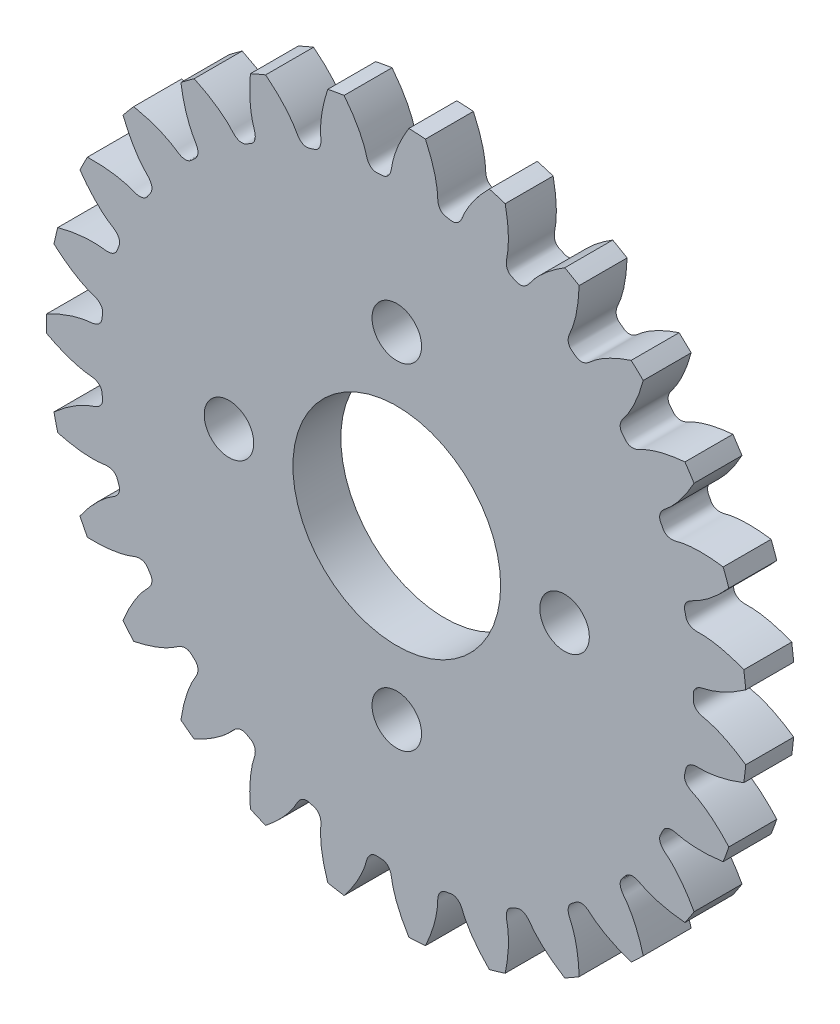
from build123d import *

# Parameters (mm, degrees)
SKETCH_334_W               = 3
SKETCH_334_H               = 21.929999671
CUT_EXTRUDE_579_DEPTH      = 1.5
PATTERN_CIRCULAR_631_COUNT = 27
SKETCH_5_R                 = 6.5
SKETCH_5_R_2               = 1.55
CUT_EXTRUDE_2_DEPTH        = 10


with BuildPart() as part:
    # Sketch 334 → Revolve 360 (revolve)
    with BuildSketch(Plane(origin=(0, 0, 0), x_dir=(0, 0, -1), z_dir=(1, 0, 0))):
        with Locations((0, 10.964999836)):
            Rectangle(SKETCH_334_W, SKETCH_334_H)
    revolve(axis=Axis((0, 0, 0), (0, 0, -1)))

    # Sketch 405 → Cut-Extrude 579 (cut, symmetric)
    with BuildSketch(Plane.XY):
        with BuildLine():
            ThreePointArc((21.914982429, 2.085599809), (22.013999669, 0), (21.914982429, -2.085599809))
            add(Edge.make_bspline(
                [(21.914982429, -2.085599809), (21.871911949, -2.054738562), (21.807384847, -2.009200425), (21.721241428, -1.949812773), (21.65756037, -1.906590462), (21.594403253, -1.864391236), (21.531781543, -1.823205162), (21.469706589, -1.783022194), (21.408189623, -1.743832174), (21.347241759, -1.705624836), (21.28687399, -1.668389802), (21.227097187, -1.632116588), (21.1679221, -1.596794605), (21.109359357, -1.562413158), (21.05141946, -1.528961446), (20.994112787, -1.496428568), (20.937449592, -1.464803521), (20.881439999, -1.434075201), (20.826094007, -1.404232406), (20.771421485, -1.375263835), (20.717432173, -1.347158092), (20.664135681, -1.319903685), (20.611541487, -1.293489029), (20.559658939, -1.267902447), (20.508497249, -1.243132169), (20.458065498, -1.219166337), (20.408372631, -1.195993002), (20.359427459, -1.173600131), (20.311238655, -1.151975603), (20.263814757, -1.131107212), (20.217164164, -1.110982672), (20.171295138, -1.091589611), (20.1262158, -1.072915579), (20.081934132, -1.054948047), (20.038457976, -1.037674408), (19.995795032, -1.021081978), (19.953952858, -1.005157998), (19.91293887, -0.989889636), (19.87276034, -0.975263989), (19.833424395, -0.961268082), (19.794938021, -0.947888869), (19.757308053, -0.93511324), (19.720541186, -0.922928015), (19.684643964, -0.911319952), (19.649622787, -0.900275742), (19.615483905, -0.889782016), (19.582233422, -0.879825345), (19.549877292, -0.870392238), (19.518421319, -0.861469149), (19.487871158, -0.853042474), (19.458232314, -0.845098556), (19.429510142, -0.837623678), (19.401709841, -0.830604091), (19.374836469, -0.824025931), (19.348894902, -0.817875508), (19.323889964, -0.812138302), (19.299825974, -0.806802499), (19.27670833, -0.801846572), (19.222676968, -0.790724281), (19.162935982, -0.779217933), (19.098568627, -0.76206523), (19.06011789, -0.750648725), (19.022340899, -0.738061196), (18.985117559, -0.724195535), (18.948320307, -0.708866633), (18.911807802, -0.691841186), (18.875432677, -0.672809247), (18.839052731, -0.651366341), (18.802553503, -0.626988394), (18.765887858, -0.599007665), (18.729141565, -0.566596695), (18.692633747, -0.528778468), (18.657053155, -0.484493888), (18.623611419, -0.432772409), (18.594132522, -0.373037294), (18.571004533, -0.305549789), (18.557343523, -0.235279067), (18.551942643, -0.132625981), (18.557175511, 0), (18.551942643, 0.132625981), (18.557343523, 0.235279067), (18.571004533, 0.305549789), (18.594132522, 0.373037294), (18.623611419, 0.432772409), (18.657053155, 0.484493888), (18.692633747, 0.528778468), (18.729141565, 0.566596695), (18.765887858, 0.599007665), (18.802553503, 0.626988394), (18.839052731, 0.651366341), (18.875432677, 0.672809247), (18.911807802, 0.691841186), (18.948320307, 0.708866633), (18.985117559, 0.724195535), (19.022340899, 0.738061196), (19.06011789, 0.750648725), (19.098568627, 0.76206523), (19.162935982, 0.779217933), (19.222676968, 0.790724281), (19.27670833, 0.801846572), (19.299825974, 0.806802499), (19.323889964, 0.812138302), (19.348894902, 0.817875508), (19.374836469, 0.824025931), (19.401709841, 0.830604091), (19.429510142, 0.837623678), (19.458232314, 0.845098556), (19.487871158, 0.853042474), (19.518421319, 0.861469149), (19.549877292, 0.870392238), (19.582233422, 0.879825345), (19.615483905, 0.889782016), (19.649622787, 0.900275742), (19.684643964, 0.911319952), (19.720541186, 0.922928015), (19.757308053, 0.93511324), (19.794938021, 0.947888869), (19.833424395, 0.961268082), (19.87276034, 0.975263989), (19.91293887, 0.989889636), (19.953952858, 1.005157998), (19.995795032, 1.021081978), (20.038457976, 1.037674408), (20.081934132, 1.054948047), (20.1262158, 1.072915579), (20.171295138, 1.091589611), (20.217164164, 1.110982672), (20.263814757, 1.131107212), (20.311238655, 1.151975603), (20.359427459, 1.173600131), (20.408372631, 1.195993002), (20.458065498, 1.219166337), (20.508497249, 1.243132169), (20.559658939, 1.267902447), (20.611541487, 1.293489029), (20.664135681, 1.319903685), (20.717432173, 1.347158092), (20.771421485, 1.375263835), (20.826094007, 1.404232406), (20.881439999, 1.434075201), (20.937449592, 1.464803521), (20.994112787, 1.496428568), (21.05141946, 1.528961446), (21.109359357, 1.562413158), (21.1679221, 1.596794605), (21.227097187, 1.632116588), (21.28687399, 1.668389802), (21.347241759, 1.705624836), (21.408189623, 1.743832174), (21.469706589, 1.783022194), (21.531781543, 1.823205162), (21.594403253, 1.864391236), (21.65756037, 1.906590462), (21.721241428, 1.949812773), (21.807384847, 2.009200425), (21.871911949, 2.054738562), (21.914982429, 2.085599809)],
                knots=[0, 0, 0, 0, 0.019049281, 0.028393074, 0.037616301, 0.046718964, 0.055701062, 0.064562594, 0.073303561, 0.081923964, 0.090423801, 0.098803073, 0.107061781, 0.115199923, 0.1232175, 0.131114512, 0.138890959, 0.14654684, 0.154082157, 0.161496909, 0.168791096, 0.175964717, 0.183017774, 0.189950265, 0.196762191, 0.203453553, 0.210024349, 0.21647458, 0.222804246, 0.229013347, 0.235101883, 0.241069854, 0.24691726, 0.2526441, 0.258250376, 0.263736087, 0.269101232, 0.274345813, 0.279469828, 0.284473278, 0.289356164, 0.294118484, 0.298760239, 0.303281429, 0.307682054, 0.311962114, 0.316121609, 0.320160539, 0.324078903, 0.327876703, 0.331553938, 0.335110607, 0.338546712, 0.341862251, 0.345057225, 0.348131634, 0.351085479, 0.353918758, 0.356631472, 0.370918927, 0.375774579, 0.380574239, 0.38533738, 0.390087288, 0.394851909, 0.399664856, 0.40456658, 0.409605628, 0.414839852, 0.420337186, 0.426175283, 0.432438789, 0.439212323, 0.446566889, 0.454538358, 0.463100513, 0.472142355, 0.4801731, 0.5, 0.5198269, 0.527857645, 0.536899487, 0.545461642, 0.553433111, 0.560787677, 0.567561211, 0.573824717, 0.579662814, 0.585160148, 0.590394372, 0.59543342, 0.600335144, 0.605148091, 0.609912712, 0.61466262, 0.619425761, 0.624225421, 0.629081073, 0.643368528, 0.646081242, 0.648914521, 0.651868366, 0.654942775, 0.658137749, 0.661453288, 0.664889393, 0.668446062, 0.672123297, 0.675921097, 0.679839461, 0.683878391, 0.688037886, 0.692317946, 0.696718571, 0.701239761, 0.705881516, 0.710643836, 0.715526722, 0.720530172, 0.725654187, 0.730898768, 0.736263913, 0.741749624, 0.7473559, 0.75308274, 0.758930146, 0.764898117, 0.770986653, 0.777195754, 0.78352542, 0.789975651, 0.796546447, 0.803237809, 0.810049735, 0.816982226, 0.824035283, 0.831208904, 0.838503091, 0.845917843, 0.85345316, 0.861109041, 0.868885488, 0.8767825, 0.884800077, 0.892938219, 0.901196927, 0.909576199, 0.918076036, 0.926696439, 0.935437406, 0.944298938, 0.953281036, 0.962383699, 0.971606926, 0.980950719, 1, 1, 1, 1], degree=3))
        make_face()
    cut_extrude_579 = extrude(amount=CUT_EXTRUDE_579_DEPTH, both=True, mode=Mode.SUBTRACT)

    # Pattern Circular 631: Cut-Extrude 579 ×27 about axis
    pattern_circular_631_axis = Axis((0, 0, 55), (0, 0, -1))
    for i in range(1, PATTERN_CIRCULAR_631_COUNT):
        add(cut_extrude_579.rotate(pattern_circular_631_axis, i * 360 / PATTERN_CIRCULAR_631_COUNT), mode=Mode.SUBTRACT)

    # 草图5 → 切除-拉伸2 (cut)
    with BuildSketch(Plane.XY.offset(1.5)):
        Circle(SKETCH_5_R)
        with Locations((0, 10.5)):
            Circle(SKETCH_5_R_2)
        with Locations((10.5, 0)):
            Circle(SKETCH_5_R_2)
        with Locations((0, -10.5)):
            Circle(SKETCH_5_R_2)
        with Locations((-10.5, 0)):
            Circle(SKETCH_5_R_2)
    extrude(amount=-CUT_EXTRUDE_2_DEPTH, mode=Mode.SUBTRACT)


solid = part.part
